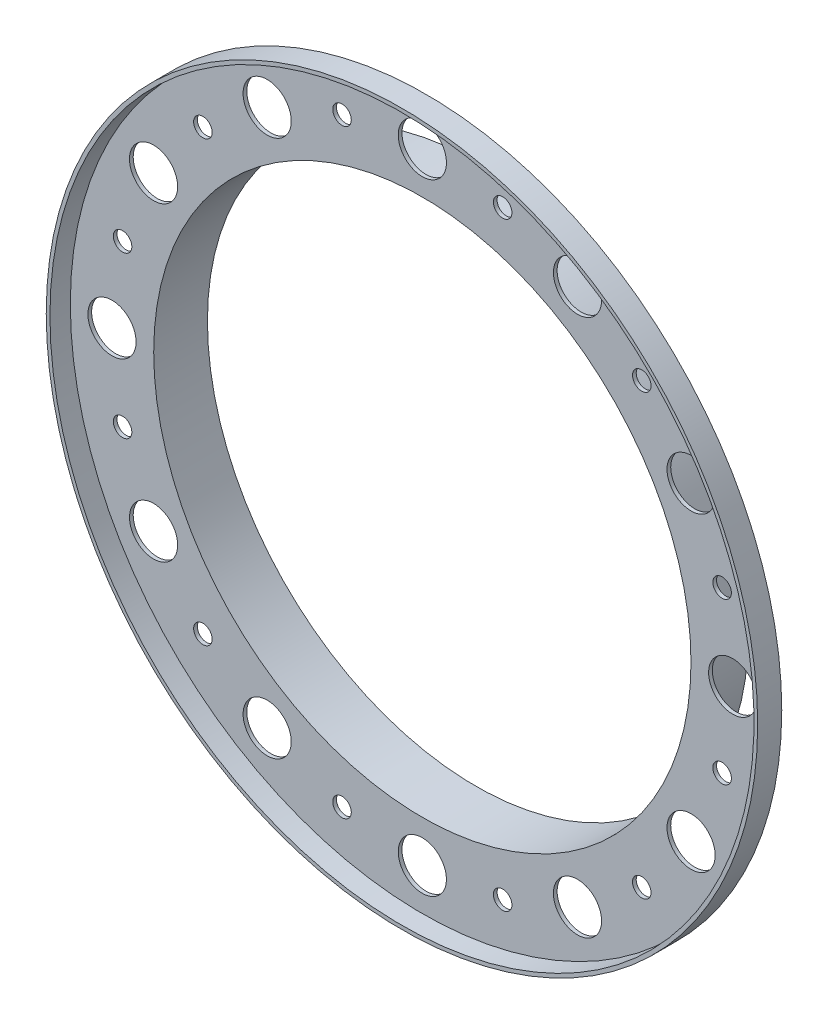
from build123d import *

# Parameters (mm, degrees)
SKETCH2_R          = 2.6
SKETCH2_R_2        = 1
CUT_EXTRUDE1_DEPTH = 55.614650049
CIRPATTERN1_COUNT  = 12


with BuildPart() as part:
    # Sketch1 → Revolve-Thin1 (revolve)
    with BuildSketch(Plane(origin=(0, 0, 0), x_dir=(0, 0, -1), z_dir=(1, 0, 0)), mode=Mode.PRIVATE) as revolve_thin1_sk:
        Polygon((0, 29), (-5.8, 29), (-5.8, 38), (-8, 38), (-8, 38.4), (-5.4, 38.4), (-5.4, 29.4), (0, 29.4), align=None)
    revolve(revolve_thin1_sk.sketch.rotate(Axis((0, 0, 0), (0, 0, 1)), 90), axis=Axis((0, 0, 0), (0, 0, 1)))

    # Sketch2 → Cut-Extrude1 (cut, through all)
    with BuildSketch(Plane.XY.offset(5.8)):
        with Locations((0, 33.5)):
            Circle(SKETCH2_R)
        with Locations((-8.670438011, 32.358515181)):
            Circle(SKETCH2_R_2)
    cut_extrude1 = extrude(amount=-CUT_EXTRUDE1_DEPTH, mode=Mode.SUBTRACT)

    # CirPattern1: Cut-Extrude1 ×12 about axis
    cirpattern1_axis = Axis((0, 0, 0), (0, 0, 1))
    for i in range(1, CIRPATTERN1_COUNT):
        add(cut_extrude1.rotate(cirpattern1_axis, i * 360 / CIRPATTERN1_COUNT), mode=Mode.SUBTRACT)


solid = part.part
